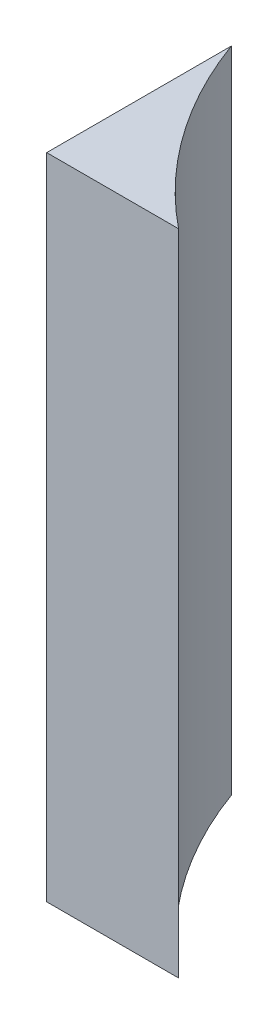
from build123d import *

# Parameters (mm, degrees)
BOSS_EXTRUDE1_DEPTH = 123


with BuildPart() as part:
    # Sketch1 → Boss-Extrude1 (new body)
    with BuildSketch(Plane(origin=(0, 0, 0), x_dir=(1, 0, 0), z_dir=(0, 1, 0))):
        with BuildLine():
            Line((0, 0), (0, 35))
            ThreePointArc((0, 35), (10.103697361, 15.788355258), (25, 0))
            Line((25, 0), (0, 0))
        make_face()
    extrude(amount=BOSS_EXTRUDE1_DEPTH)


solid = part.part
